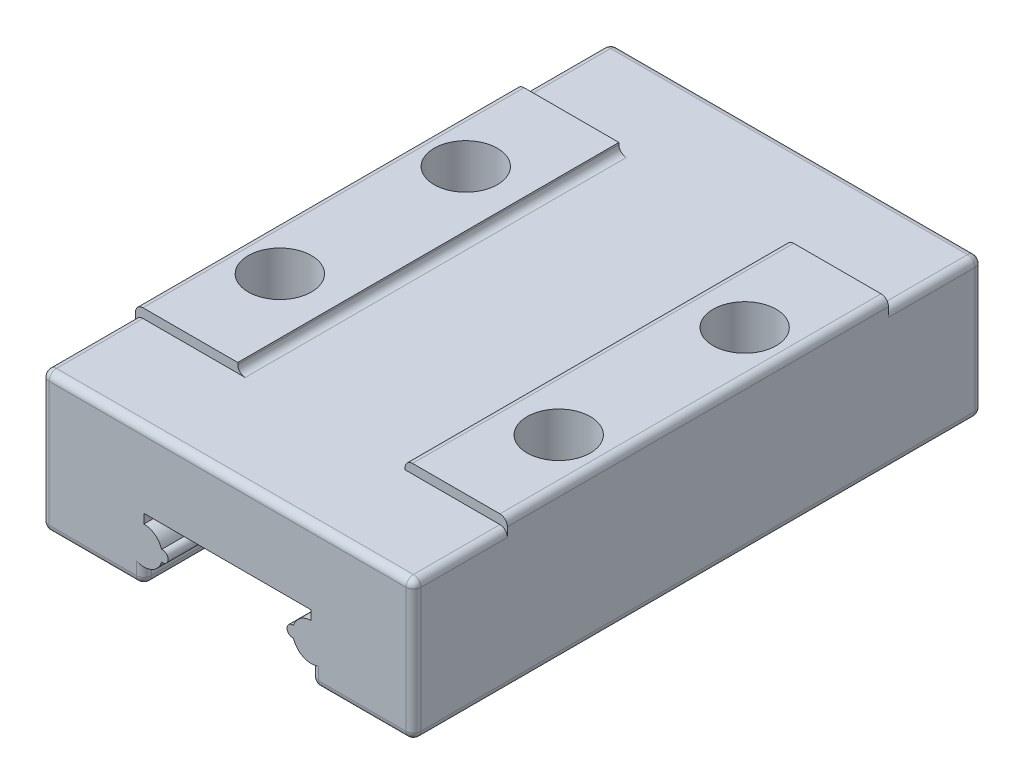
from build123d import *

# Parameters (mm, degrees)
SKETCH1_R           = 1
SKETCH1_R_2         = 0.3
BOSS_EXTRUDE1_DEPTH = 30.6
SKETCH2_W           = 20
SKETCH2_H           = 5.05
CUT_EXTRUDE1_DEPTH  = 0.5
SKETCH4_W           = 4.5
SKETCH4_H           = 0.5
CUT_EXTRUDE2_DEPTH  = 21.5
SKETCH5_R           = 1.7
CUT_EXTRUDE3_DEPTH  = 3
FILLET1_R           = 0.4
FILLET2_R           = 0.4


with BuildPart() as part:
    # Sketch1 → Boss-Extrude1 (new body)
    with BuildSketch(Plane.XY):
        with BuildLine():
            Line((-4.5, 2.25), (-4.5, 2.75))
            Line((-4.5, 2.75), (4.5, 2.75))
            Line((4.5, 2.75), (4.5, 2.25))
            ThreePointArc((4.5, 2.25), (5.207106781, 1.957106781), (5.5, 1.25))
            ThreePointArc((5.5, 1.25), (5.207106781, 0.542893219), (4.5, 0.25))
            Line((4.5, 0.25), (4.5, -0.75))
            Line((4.5, -0.75), (10, -0.75))
            Line((10, -0.75), (10, 7.25))
            Line((10, 7.25), (-10, 7.25))
            Line((-10, 7.25), (-10, -0.75))
            Line((-10, -0.75), (-4.5, -0.75))
            Line((-4.5, -0.75), (-4.5, 0.25))
            ThreePointArc((-4.5, 0.25), (-5.5, 1.25), (-4.5, 2.25))
        make_face()
        with BuildLine():
            Line((-4.5, 1.25), (-4.5, 2.25))
            ThreePointArc((-4.5, 2.25), (-5.5, 1.25), (-4.5, 0.25))
            Line((-4.5, 0.25), (-4.5, 1.25))
        make_face()
        with BuildLine():
            ThreePointArc((-3.545, 1.546605799), (-3.906959444, 2.05517259), (-4.5, 2.25))
            Line((-4.5, 2.25), (-4.5, 1.25))
            Line((-4.5, 1.25), (-4.5, 0.25))
            ThreePointArc((-4.5, 0.25), (-3.906959444, 0.44482741), (-3.545, 0.953394201))
            ThreePointArc((-3.545, 0.953394201), (-3.8, 1.25), (-3.545, 1.546605799))
        make_face()
        with Locations((-4.5, 1.25)):
            Circle(SKETCH1_R)
        with Locations((-3.5, 1.25)):
            Circle(SKETCH1_R_2)
        with Locations((3.5, 1.25)):
            Circle(SKETCH1_R_2)
        with Locations((4.5, 1.25)):
            Circle(SKETCH1_R)
        with BuildLine():
            Line((4.5, 0.25), (4.5, 2.25))
            ThreePointArc((4.5, 2.25), (3.906959444, 2.05517259), (3.545, 1.546605799))
            ThreePointArc((3.545, 1.546605799), (3.727486263, 1.445576072), (3.8, 1.25))
            ThreePointArc((3.8, 1.25), (3.727486263, 1.054423928), (3.545, 0.953394201))
            ThreePointArc((3.545, 0.953394201), (3.906959444, 0.44482741), (4.5, 0.25))
        make_face()
        with BuildLine():
            ThreePointArc((5.5, 1.25), (5.207106781, 1.957106781), (4.5, 2.25))
            Line((4.5, 2.25), (4.5, 0.25))
            ThreePointArc((4.5, 0.25), (5.207106781, 0.542893219), (5.5, 1.25))
        make_face()
    extrude(amount=BOSS_EXTRUDE1_DEPTH)

    # Sketch2 → Cut-Extrude1 (cut)
    with BuildSketch(Plane(origin=(0, 7.25, 0), x_dir=(1, 0, 0), z_dir=(0, 1, 0))):
        with Locations((0, -2.525)):
            Rectangle(SKETCH2_W, SKETCH2_H)
        with Locations((0, -28.075)):
            Rectangle(SKETCH2_W, SKETCH2_H)
    extrude(amount=-CUT_EXTRUDE1_DEPTH, mode=Mode.SUBTRACT)

    # Sketch4 → Cut-Extrude2 (cut)
    with BuildSketch(Plane.XY.offset(25.55)):
        with Locations((-2.25, 7)):
            Rectangle(SKETCH4_W, SKETCH4_H)
        with Locations((2.25, 7)):
            Rectangle(SKETCH4_W, SKETCH4_H)
    extrude(amount=-CUT_EXTRUDE2_DEPTH, mode=Mode.SUBTRACT)

    # Sketch5 → Cut-Extrude3 (cut)
    with BuildSketch(Plane(origin=(0, 7.25, 0), x_dir=(1, 0, 0), z_dir=(0, 1, 0))):
        with BuildLine():
            ThreePointArc((-7.5, -18.586900159), (-8.702081528, -21.488981687), (-5.8, -20.286900159))
            Line((-5.8, -20.286900159), (-7.5, -20.286900159))
            Line((-7.5, -20.286900159), (-7.5, -18.586900159))
        make_face()
        with BuildLine():
            Line((-7.5, -20.286900159), (-5.8, -20.286900159))
            ThreePointArc((-5.8, -20.286900159), (-6.297918472, -19.084818631), (-7.5, -18.586900159))
            Line((-7.5, -18.586900159), (-7.5, -20.286900159))
        make_face()
        with BuildLine():
            ThreePointArc((7.5, -18.586900159), (6.297918472, -19.084818631), (5.8, -20.286900159))
            Line((5.8, -20.286900159), (7.5, -20.286900159))
            Line((7.5, -20.286900159), (7.5, -18.586900159))
        make_face()
        with BuildLine():
            Line((7.5, -20.286900159), (5.8, -20.286900159))
            ThreePointArc((5.8, -20.286900159), (7.5, -21.986900159), (9.2, -20.286900159))
            ThreePointArc((9.2, -20.286900159), (8.702081528, -19.084818631), (7.5, -18.586900159))
            Line((7.5, -18.586900159), (7.5, -20.286900159))
        make_face()
        with BuildLine():
            ThreePointArc((9.2, -10.286900159), (7.5, -8.586900159), (5.8, -10.286900159))
            Line((5.8, -10.286900159), (7.5, -10.286900159))
            Line((7.5, -10.286900159), (7.5, -11.986900159))
            ThreePointArc((7.5, -11.986900159), (8.702081528, -11.488981687), (9.2, -10.286900159))
        make_face()
        with BuildLine():
            Line((7.5, -10.286900159), (5.8, -10.286900159))
            ThreePointArc((5.8, -10.286900159), (6.297918472, -11.488981687), (7.5, -11.986900159))
            Line((7.5, -11.986900159), (7.5, -10.286900159))
        make_face()
        with Locations(Location((-7.5, -10.286900159, 0), (0, 0, 90))):
            Circle(SKETCH5_R)
    extrude(amount=-CUT_EXTRUDE3_DEPTH, mode=Mode.SUBTRACT)

    # Fillet1
    fillet1_edges = [part.edges().sort_by_distance(p)[0] for p in [
        (-4.5, -0.75, 15.3),
        (-10, -0.75, 15.3),
        (10, -0.75, 15.3),
        (4.5, -0.75, 15.3),
        (-10, 7.25, 15.3),
        (10, 7.25, 15.3),
        (-10, 6.75, 2.525),
        (10, 6.75, 2.525),
        (10, 6.75, 28.075),
        (-10, 6.75, 28.075),
        (-4.5, 6.75, 15.3),
        (4.5, 7.25, 15.3),
    ]]
    fillet(fillet1_edges, radius=FILLET1_R)

    # Fillet2
    fillet2_edges = [part.edges().sort_by_distance(p)[0] for p in [
        (7.25, -0.75, 0),
        (7.25, -0.75, 30.6),
        (0, 6.75, 0),
        (10, 3, 0),
        (4.5, -0.05, 0),
        (-4.5, -0.05, 0),
        (-7.25, -0.75, 0),
        (-10, 3, 0),
        (-9.882842712, 6.632842712, 0),
        (9.882842712, 6.632842712, 0),
        (-9.882842712, -0.632842712, 0),
        (-4.617157288, -0.632842712, 0),
        (9.882842712, -0.632842712, 0),
        (4.617157288, -0.632842712, 0),
        (4.5, -0.05, 30.6),
        (10, 3, 30.6),
        (0, 6.75, 30.6),
        (-10, 3, 30.6),
        (-7.25, -0.75, 30.6),
        (-4.5, -0.05, 30.6),
        (-9.882842712, 6.632842712, 30.6),
        (9.882842712, 6.632842712, 30.6),
        (-9.882842712, -0.632842712, 30.6),
        (-4.617157288, -0.632842712, 30.6),
        (9.882842712, -0.632842712, 30.6),
        (4.617157288, -0.632842712, 30.6),
    ]]
    fillet(fillet2_edges, radius=FILLET2_R)


solid = part.part
